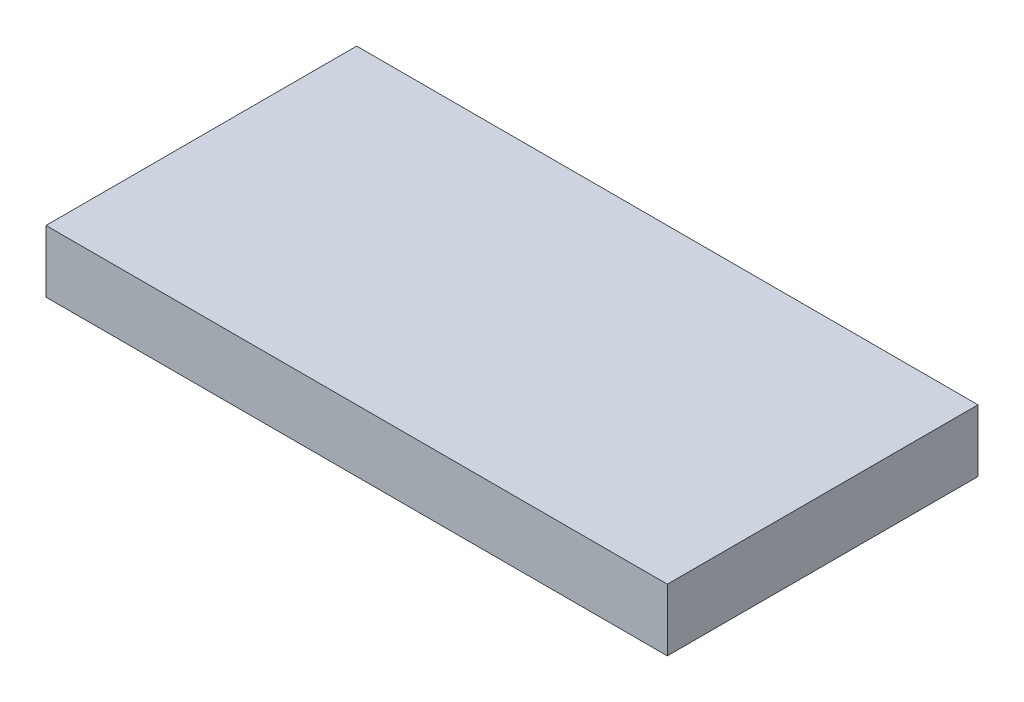
from build123d import *

# Parameters (mm, degrees)
SKETCH1_W           = 30
SKETCH1_H           = 15
BOSS_EXTRUDE1_DEPTH = 3


with BuildPart() as part:
    # Sketch1 → Boss-Extrude1 (new body)
    with BuildSketch(Plane(origin=(0, 0, 0), x_dir=(1, 0, 0), z_dir=(0, 1, 0))):
        Rectangle(SKETCH1_W, SKETCH1_H)
    extrude(amount=BOSS_EXTRUDE1_DEPTH)


solid = part.part
